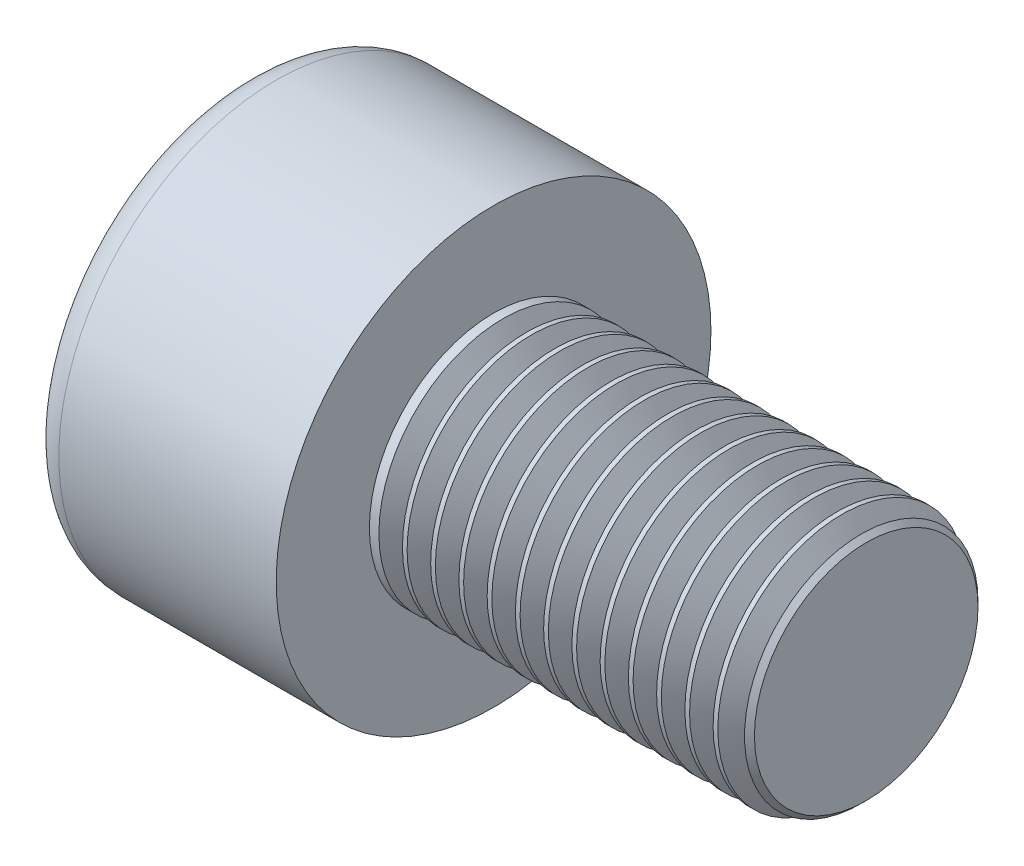
from build123d import *

# Parameters (mm, degrees)
SKETCH1_R           = 3.5
BASEHEAD_DEPTH      = 4
SKETCH2_R           = 2
BASEBODY_DEPTH      = 6
HEXAGONSOCKET_DEPTH = 2
TOPFILLET_R         = 0.5
CHAMFER1_SIZE       = 0.2
LPATTERN10_COUNT    = 13
LPATTERN10_PITCH    = 0.4548


with BuildPart() as part:
    # Sketch1 → BaseHead (new body)
    with BuildSketch(Plane(origin=(0, 0, 0), x_dir=(0, 0, -1), z_dir=(1, 0, 0))):
        Circle(SKETCH1_R)
    extrude(amount=BASEHEAD_DEPTH)

    # Sketch2 → BaseBody (add)
    with BuildSketch(Plane(origin=(4, 0, 0), x_dir=(0, 0, -1), z_dir=(1, 0, 0))):
        Circle(SKETCH2_R)
    extrude(amount=BASEBODY_DEPTH)

    # Sketch3 → HexagonSocket (cut)
    with BuildSketch(Plane(origin=(0, 0, 0), x_dir=(0, 0, -1), z_dir=(1, 0, 0))):
        Polygon((1.732050808, 0), (0.866025404, 1.5), (-0.866025404, 1.5), (-1.732050808, 0), (-0.866025404, -1.5), (0.866025404, -1.5), align=None)
    extrude(amount=HEXAGONSOCKET_DEPTH, mode=Mode.SUBTRACT)

    # Sketch4 → Cut-Revolve1 (revolve, cut)
    with BuildSketch(Plane(origin=(-4.19613823, 0.75, 0), x_dir=(-1, 0, 0), z_dir=(0, 0, 1)), mode=Mode.PRIVATE) as cut_revolve1_sk:
        Polygon((-6.19613823, 2.25), (-7.062163633, 0.75), (-6.19613823, 0.75), align=None)
    revolve(cut_revolve1_sk.sketch.rotate(Axis((0.838992387, 0, 0), (-1, 0, 0)), 90), axis=Axis((0.838992387, 0, 0), (-1, 0, 0)), mode=Mode.SUBTRACT)

    # TopFillet
    topfillet_edges = [part.edges().sort_by_distance(p)[0] for p in [
        (0, 0, 3.5),
    ]]
    fillet(topfillet_edges, radius=TOPFILLET_R)

    # Chamfer1
    chamfer1_edges = [part.edges().sort_by_distance(p)[0] for p in [
        (10, 0, 2),
    ]]
    chamfer(chamfer1_edges, length=CHAMFER1_SIZE)

    # Sketch5 → Cut-Revolve10 (revolve, cut)
    with BuildSketch(Plane.XY, mode=Mode.PRIVATE) as cut_revolve10_sk:
        Polygon((9.8, 1.671776372), (9.9895, 2), (9.9895, 2.379), (9.6105, 2.379), (9.6105, 2), align=None)
    cut_revolve10 = revolve(cut_revolve10_sk.sketch.rotate(Axis((0, 0, 0), (1, 0, 0)), 90), axis=Axis((0, 0, 0), (1, 0, 0)), mode=Mode.SUBTRACT)

    # LPattern10: Cut-Revolve10 ×13
    with Locations(*[(-i * LPATTERN10_PITCH, 0, 0) for i in range(1, LPATTERN10_COUNT)]):
        add(cut_revolve10, mode=Mode.SUBTRACT)


solid = part.part
